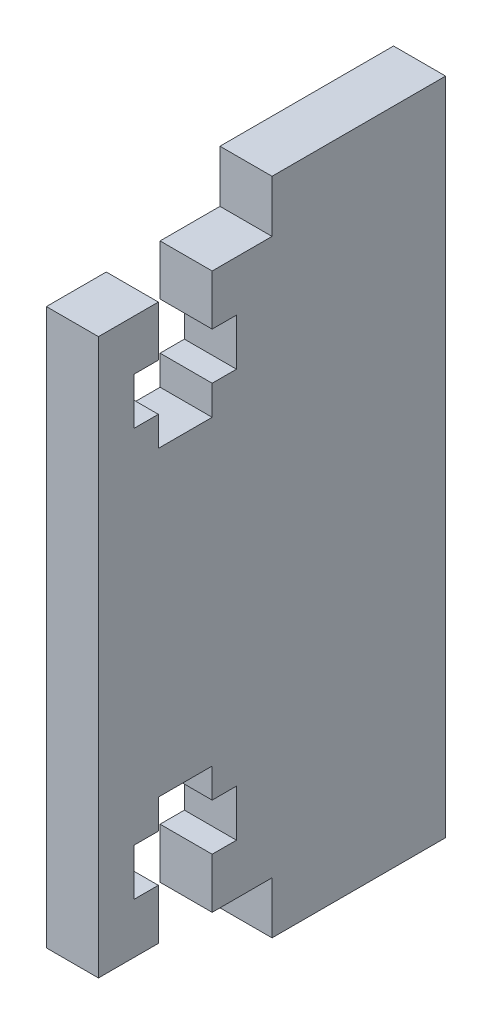
from build123d import *

# Parameters (mm, degrees)
SKETCH1_W           = 20
SKETCH1_H           = 38
BOSS_EXTRUDE1_DEPTH = 3
SKETCH2_W           = 10
SKETCH2_H           = 3
CUT_EXTRUDE1_DEPTH  = 3
CUT_EXTRUDE2_DEPTH  = 3


with BuildPart() as part:
    # Sketch1 → Boss-Extrude1 (new body)
    with BuildSketch(Plane(origin=(0, 0, 0), x_dir=(0, 0, -1), z_dir=(1, 0, 0))):
        with Locations((10, 19)):
            Rectangle(SKETCH1_W, SKETCH1_H)
    extrude(amount=BOSS_EXTRUDE1_DEPTH)

    # Sketch2 → Cut-Extrude1 (cut)
    with BuildSketch(Plane(origin=(3, 0, 0), x_dir=(0, 0, -1), z_dir=(1, 0, 0))):
        with Locations((5, 36.5)):
            Rectangle(SKETCH2_W, SKETCH2_H)
        with Locations((5, 1.5)):
            Rectangle(SKETCH2_W, SKETCH2_H)
    extrude(amount=-CUT_EXTRUDE1_DEPTH, mode=Mode.SUBTRACT)

    # Sketch3 → Cut-Extrude2 (cut)
    with BuildSketch(Plane(origin=(3, 0, 0), x_dir=(0, 0, -1), z_dir=(1, 0, 0))):
        Polygon((3.45, 3), (3.45, 5.9), (2.05, 5.9), (2.05, 8.6), (3.45, 8.6), (3.45, 10.3), (6.55, 10.3), (6.55, 8.6), (7.95, 8.6), (7.95, 5.9), (6.55, 5.9), (6.55, 3), align=None)
        Polygon((6.55, 35), (6.55, 32.1), (7.95, 32.1), (7.95, 29.4), (6.55, 29.4), (6.55, 27.7), (3.45, 27.7), (3.45, 29.4), (2.05, 29.4), (2.05, 32.1), (3.45, 32.1), (3.45, 35), align=None)
    extrude(amount=-CUT_EXTRUDE2_DEPTH, mode=Mode.SUBTRACT)


solid = part.part
